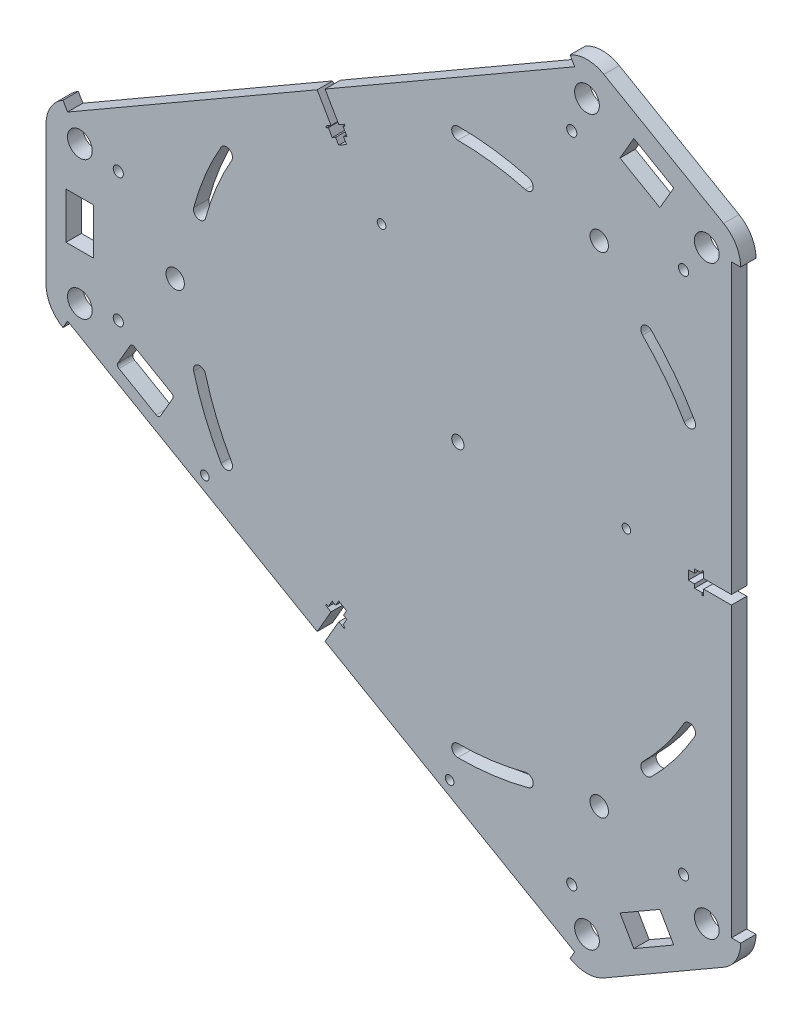
from build123d import *

# Parameters (mm, degrees)
SKETCH1_R           = 4.025
SKETCH1_R_2         = 1.65
SKETCH1_R_3         = 2
SKETCH1_R_4         = 3
SKETCH1_W           = 9
SKETCH1_H           = 15
BOSS_EXTRUDE1_DEPTH = 5
CUT_EXTRUDE1_DEPTH  = 186.946581396
SKETCH3_R           = 1.4
CUT_EXTRUDE2_DEPTH  = 186.946581396
CUT_EXTRUDE4_DEPTH  = 186.946581396
CIRPATTERN1_COUNT   = 3


with BuildPart() as part:
    # Sketch1 → Boss-Extrude1 (new body)
    with BuildSketch(Plane.XY):
        with BuildLine():
            Line((-127.0125, 29.449853865), (38.001928415, 124.720978531))
            Line((38.001928415, 124.720978531), (36.501939089, 127.319036255))
            ThreePointArc((36.501939089, 127.319036255), (42.014428415, 128.796103318), (47.526917741, 127.319036255))
            Line((47.526917741, 127.319036255), (86.498060911, 104.819036255))
            ThreePointArc((86.498060911, 104.819036255), (90.533483174, 100.783613992), (92.010550238, 95.271124665))
            Line((92.010550238, 95.271124665), (89.010571585, 95.271124665))
            Line((89.010571585, 95.271124665), (89.010571585, -95.271124665))
            Line((89.010571585, -95.271124665), (92.010550238, -95.271124665))
            ThreePointArc((92.010550238, -95.271124665), (90.671767887, -100.536839764), (86.980562177, -104.523704959))
            Line((86.980562177, -104.523704959), (47.529952044, -127.317283756))
            ThreePointArc((47.529952044, -127.317283756), (42.016179814, -128.796103179), (36.501938019, -127.319035637))
            Line((36.501938019, -127.319035637), (38.001927636, -124.720978081))
            Line((38.001927636, -124.720978081), (-127.012490105, -29.449834928))
            Line((-127.012490105, -29.449834928), (-128.512490396, -32.047910972))
            ThreePointArc((-128.512490396, -32.047910972), (-132.547911898, -28.012488791), (-134.024978652, -22.5))
            Line((-134.024978652, -22.5), (-134.024978652, 22.5))
            ThreePointArc((-134.024978652, 22.5), (-132.547911589, 28.012489326), (-128.512489326, 32.047911589))
            Line((-128.512489326, 32.047911589), (-127.0125, 29.449853865))
        make_face()
        with Locations((-123, 22.5)):
            Circle(SKETCH1_R, mode=Mode.SUBTRACT)
        with Locations((-123, -22.5)):
            Circle(SKETCH1_R, mode=Mode.SUBTRACT)
        with Locations((42.014428415, 117.771124665)):
            Circle(SKETCH1_R, mode=Mode.SUBTRACT)
        with Locations((80.985571585, 95.271124665)):
            Circle(SKETCH1_R, mode=Mode.SUBTRACT)
        with Locations((80.985571585, -95.271124665)):
            Circle(SKETCH1_R, mode=Mode.SUBTRACT)
        with Locations((42.014428415, -117.771124665)):
            Circle(SKETCH1_R, mode=Mode.SUBTRACT)
        with Locations((-110.5, 21)):
            Circle(SKETCH1_R_2, mode=Mode.SUBTRACT)
        with Locations((-110.5, -21)):
            Circle(SKETCH1_R_2, mode=Mode.SUBTRACT)
        with Locations((73.436533479, 85.195807118)):
            Circle(SKETCH1_R_2, mode=Mode.SUBTRACT)
        with Locations((37.063466521, 106.195807118)):
            Circle(SKETCH1_R_2, mode=Mode.SUBTRACT)
        with Locations((37.063466521, -106.195807118)):
            Circle(SKETCH1_R_2, mode=Mode.SUBTRACT)
        with Locations((73.436533479, -85.195807118)):
            Circle(SKETCH1_R_2, mode=Mode.SUBTRACT)
        Circle(SKETCH1_R_3, mode=Mode.SUBTRACT)
        with Locations((-92, 0)):
            Circle(SKETCH1_R_4, mode=Mode.SUBTRACT)
        with Locations((46, 79.674337148)):
            Circle(SKETCH1_R_4, mode=Mode.SUBTRACT)
        with Locations((46, -79.674337148)):
            Circle(SKETCH1_R_4, mode=Mode.SUBTRACT)
        Polygon((70.245190528, 106.668238983), (65.745190528, 98.874010348), (52.754809472, 106.374010348), (57.254809472, 114.168238983), align=None, mode=Mode.SUBTRACT)
        with Locations((-123, 0)):
            Rectangle(SKETCH1_W, SKETCH1_H, mode=Mode.SUBTRACT)
        Polygon((57.254809472, -114.168238983), (52.754809472, -106.374010348), (65.745190528, -98.874010348), (70.245190528, -106.668238983), align=None, mode=Mode.SUBTRACT)
    extrude(amount=BOSS_EXTRUDE1_DEPTH)

    # Sketch2 → Cut-Extrude1 (cut, through all)
    with BuildSketch(Plane.XY.offset(5)):
        Polygon((89.010571585, 1.48), (80.010571585, 1.48), (80.010571585, 3.5), (79.510571585, 3.5), (79.510571585, 2.75), (77.010571585, 2.75), (77.010571585, 1.48), (75.010571585, 1.48), (75.010571585, -1.48), (77.010571585, -1.48), (77.010571585, -2.75), (79.510571585, -2.75), (79.510571585, -3.5), (80.010571585, -3.5), (80.010571585, -1.48), (89.010571585, -1.48), align=None)
        Polygon((-43.223568195, -77.825416198), (-38.723568195, -70.031187564), (-36.974196879, -71.041187564), (-36.724196879, -70.608174862), (-37.373715932, -70.233174862), (-36.123715932, -68.068111353), (-37.223568195, -67.433111353), (-36.223568195, -65.701060545), (-38.78700339, -64.221060545), (-39.78700339, -65.953111353), (-40.886855653, -65.318111353), (-42.136855653, -67.483174862), (-42.786374706, -67.108174862), (-43.036374706, -67.541187564), (-41.28700339, -68.551187564), (-45.78700339, -76.345416198), align=None)
        Polygon((-45.78700339, 76.345416198), (-41.28700339, 68.551187564), (-43.036374706, 67.541187564), (-42.786374706, 67.108174862), (-42.136855653, 67.483174862), (-40.886855653, 65.318111353), (-39.78700339, 65.953111353), (-38.78700339, 64.221060545), (-36.223568195, 65.701060545), (-37.223568195, 67.433111353), (-36.123715932, 68.068111353), (-37.373715932, 70.233174862), (-36.724196879, 70.608174862), (-36.974196879, 71.041187564), (-38.723568195, 70.031187564), (-43.223568195, 77.825416198), align=None)
    extrude(amount=-CUT_EXTRUDE1_DEPTH, mode=Mode.SUBTRACT)

    # Sketch3 → Cut-Extrude2 (cut, through all)
    with BuildSketch(Plane.XY.offset(5)):
        with Locations((-82.342452032, -50.621297655)):
            Circle(SKETCH3_R)
        with Locations((-2.668120037, -96.621306581)):
            Circle(SKETCH3_R)
        with Locations((54.831891121, 2.971608412)):
            Circle(SKETCH3_R)
        with Locations((-24.842440874, 48.971617338)):
            Circle(SKETCH3_R)
        with BuildLine():
            Line((-110.290058805, -34.485735187), (-98.165703936, -41.485736545))
            ThreePointArc((-98.165703936, -41.485736545), (-97.406884902, -41.585637053), (-96.799678491, -41.119711294))
            Line((-96.799678491, -41.119711294), (-92.799677715, -34.191508512))
            ThreePointArc((-92.799677715, -34.191508512), (-92.699777207, -33.432689478), (-93.165702966, -32.825483067))
            Line((-93.165702966, -32.825483067), (-105.290057834, -25.825481709))
            ThreePointArc((-105.290057834, -25.825481709), (-106.048876868, -25.725581202), (-106.656083279, -26.19150696))
            Line((-106.656083279, -26.19150696), (-110.656084055, -33.119709742))
            ThreePointArc((-110.656084055, -33.119709742), (-110.755984563, -33.878528776), (-110.290058805, -34.485735187))
        make_face()
    extrude(amount=-CUT_EXTRUDE2_DEPTH, mode=Mode.SUBTRACT)

    # Sketch6 → Cut-Extrude4 (cut, through all)
    with BuildSketch(Plane.XY.offset(5)):
        with BuildLine():
            ThreePointArc((-77.076260937, 44.5), (-82.225278394, 34.05882548), (-85.96739854, 23.034895014))
            ThreePointArc((-85.96739854, 23.034895014), (-84.553184977, 20.585405271), (-82.103695235, 21.999618834))
            ThreePointArc((-82.103695235, 21.999618834), (-78.529760263, 32.528091751), (-73.612159322, 42.5))
            ThreePointArc((-73.612159322, 42.5), (-74.344210129, 45.232050808), (-77.076260937, 44.5))
        make_face()
        with BuildLine():
            ThreePointArc((-73.612159322, -42.5), (-74.344210129, -45.232050808), (-77.076260937, -44.5))
            ThreePointArc((-77.076260937, -44.5), (-82.225278394, -34.05882548), (-85.96739854, -23.034895014))
            ThreePointArc((-85.96739854, -23.034895014), (-84.553184977, -20.585405271), (-82.103695235, -21.999618834))
            ThreePointArc((-82.103695235, -21.999618834), (-78.529760263, -32.528091751), (-73.612159322, -42.5))
        make_face()
    cut_extrude4 = extrude(amount=-CUT_EXTRUDE4_DEPTH, mode=Mode.SUBTRACT)

    # CirPattern1: Cut-Extrude4 ×3 about axis
    cirpattern1_axis = Axis((0, 0, 5), (0, 0, -1))
    for i in range(1, CIRPATTERN1_COUNT):
        add(cut_extrude4.rotate(cirpattern1_axis, i * 360 / CIRPATTERN1_COUNT), mode=Mode.SUBTRACT)


solid = part.part
